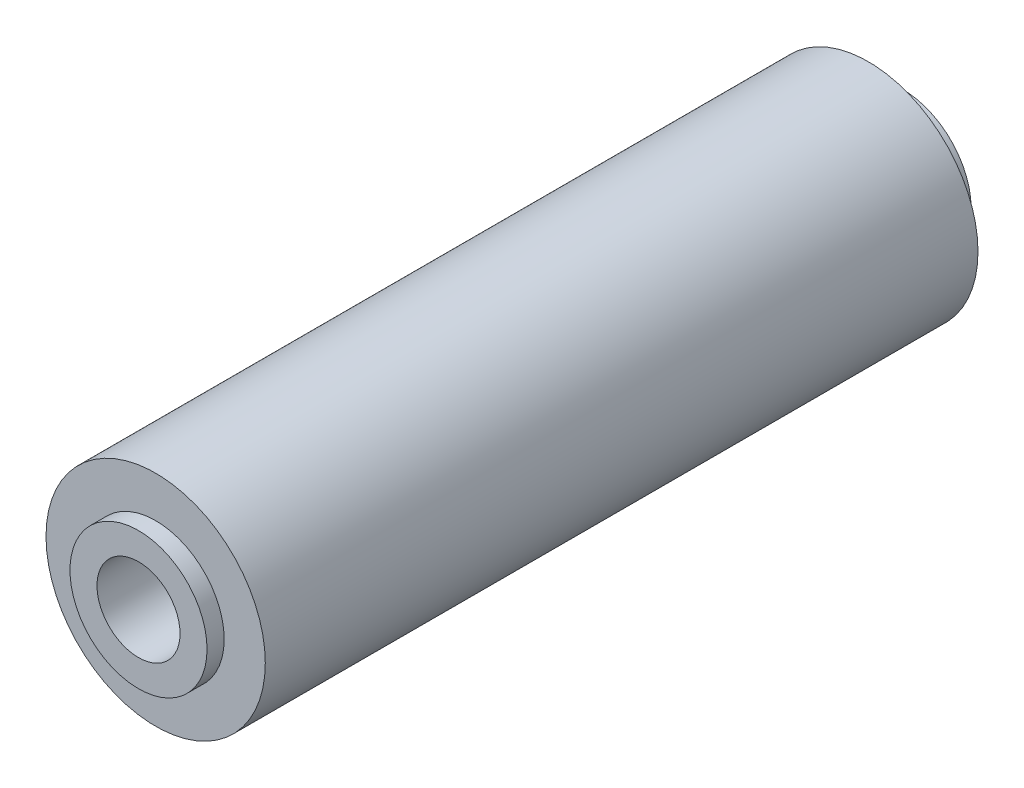
from build123d import *

# Parameters (mm, degrees)
S01_TURNED_STEEL_BODY_R               = 8
F_01_TURNED_STEEL_BODY_DEPTH          = 52
F_02_START                            = -2.5
S02_BACKPLATE_LOCATING_SPIGOT_R       = 5
F_02_BACKPLATE_LOCATING_SPIGOT_DEPTH  = 2.5
F_03_START                            = 52
S03_TRACK_LOCATING_SPIGOT_R           = 5
F_03_TRACK_LOCATING_SPIGOT_DEPTH      = 1.25
F_04_START                            = -2.6
S04_REAR_M6_THREADED_ENVELOPE_R       = 3.03
F_04_REAR_M6_THREADED_ENVELOPE_DEPTH  = 14.1
F_05_START                            = 38.5
S05_FRONT_M6_THREADED_ENVELOPE_R      = 3.03
F_05_FRONT_M6_THREADED_ENVELOPE_DEPTH = 15


with BuildPart() as part:
    # S01 - Turned steel body → 01 - Turned steel body (new body)
    with BuildSketch(Plane.XY):
        Circle(S01_TURNED_STEEL_BODY_R)
    extrude(amount=F_01_TURNED_STEEL_BODY_DEPTH)

    # S02 - Backplate locating spigot → 02 - Backplate locating spigot (add)
    with BuildSketch(Plane.XY.offset(F_02_START)):
        Circle(S02_BACKPLATE_LOCATING_SPIGOT_R)
    extrude(amount=F_02_BACKPLATE_LOCATING_SPIGOT_DEPTH)

    # S03 - Track locating spigot → 03 - Track locating spigot (add)
    with BuildSketch(Plane.XY.offset(F_03_START)):
        Circle(S03_TRACK_LOCATING_SPIGOT_R)
    extrude(amount=F_03_TRACK_LOCATING_SPIGOT_DEPTH)

    # S04 - Rear M6 threaded envelope → 04 - Rear M6 threaded envelope (cut)
    with BuildSketch(Plane.XY.offset(F_04_START)):
        Circle(S04_REAR_M6_THREADED_ENVELOPE_R)
    extrude(amount=F_04_REAR_M6_THREADED_ENVELOPE_DEPTH, mode=Mode.SUBTRACT)

    # S05 - Front M6 threaded envelope → 05 - Front M6 threaded envelope (cut)
    with BuildSketch(Plane.XY.offset(F_05_START)):
        Circle(S05_FRONT_M6_THREADED_ENVELOPE_R)
    extrude(amount=F_05_FRONT_M6_THREADED_ENVELOPE_DEPTH, mode=Mode.SUBTRACT)


solid = part.part
